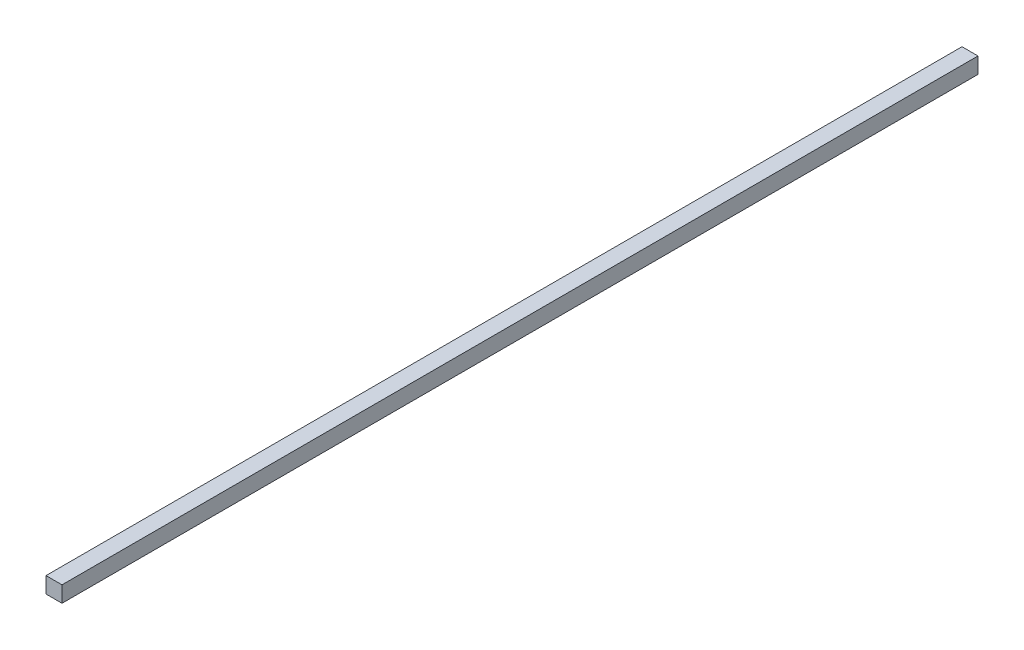
from build123d import *

# Parameters (mm, degrees)
SKETCH1_W           = 20
SKETCH1_H           = 20
BOSS_EXTRUDE1_DEPTH = 1145


with BuildPart() as part:
    # Sketch1 → Boss-Extrude1 (new body)
    with BuildSketch(Plane.XY):
        Rectangle(SKETCH1_W, SKETCH1_H)
    extrude(amount=BOSS_EXTRUDE1_DEPTH)


solid = part.part
